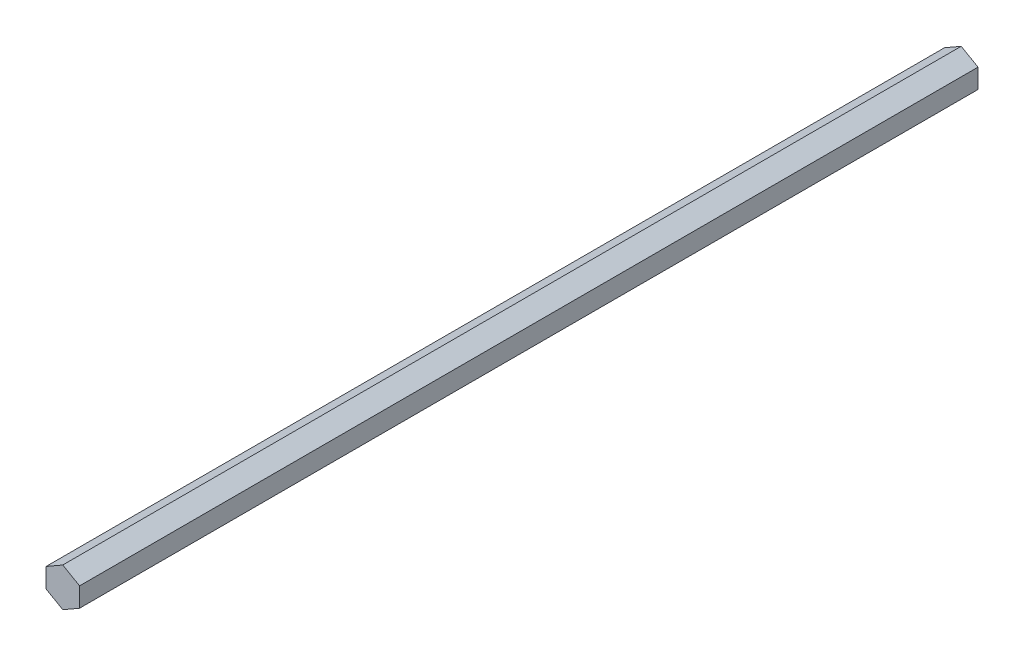
from build123d import *

# Parameters (mm, degrees)
BOSS_EXTRUDE1_DEPTH = 340


with BuildPart() as part:
    # Sketch1 → Boss-Extrude1 (new body)
    with BuildSketch(Plane.XY):
        Polygon((0, 7.332348419), (-6.35, 3.666174209), (-6.35, -3.666174209), (0, -7.332348419), (6.35, -3.666174209), (6.35, 3.666174209), align=None)
    extrude(amount=BOSS_EXTRUDE1_DEPTH)


solid = part.part
